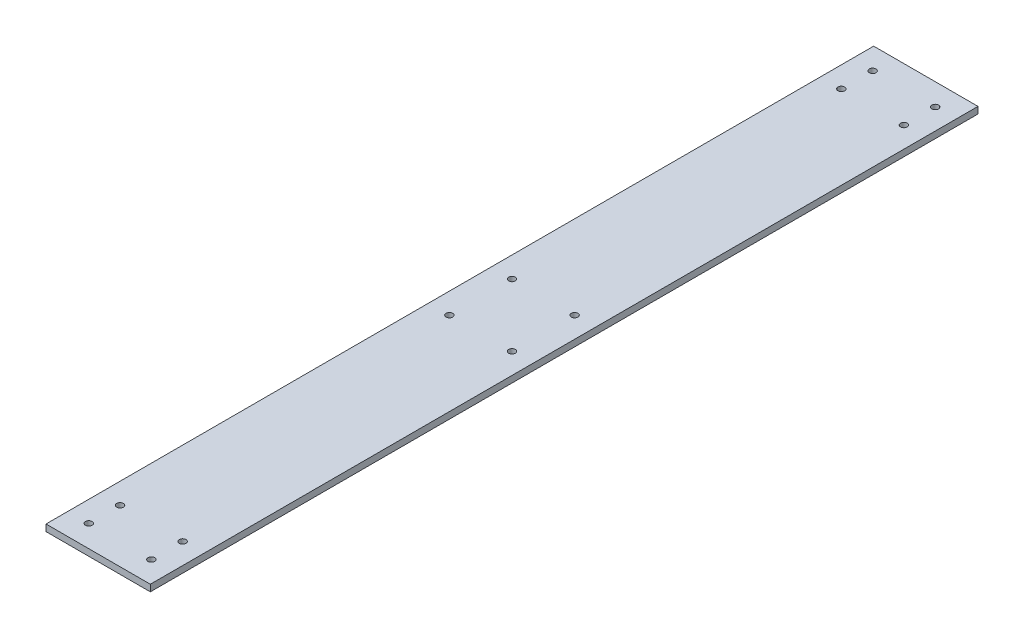
from build123d import *

# Parameters (mm, degrees)
SKETCH1_W            = 50
SKETCH1_H            = 396.65
BOSS_EXTRUDE1_DEPTH  = 3.175
M3_CLEARANCE_HOLE1_D = 3.2
M3_CLEARANCE_HOLE2_D = 3.2


with BuildPart() as part:
    # Sketch1 → Boss-Extrude1 (new body)
    with BuildSketch(Plane(origin=(0, 0, 0), x_dir=(1, 0, 0), z_dir=(0, 1, 0))):
        Rectangle(SKETCH1_W, SKETCH1_H)
    extrude(amount=BOSS_EXTRUDE1_DEPTH)

    # M3 Clearance Hole1 (through all)
    with Locations(Plane(origin=(0, 0, 0), x_dir=(-1, 0, 0), z_dir=(0, -1, 0))):
        with Locations((15, -187.825), (-15, -172.825), (-15, -187.825), (15, -172.825)):
            m3_clearance_hole1 = Hole(M3_CLEARANCE_HOLE1_D / 2)

    # Mirror1: M3 Clearance Hole1 across plane
    add(m3_clearance_hole1.mirror(Plane.XY), mode=Mode.SUBTRACT)

    # M3 Clearance Hole2 (through all)
    with Locations(Plane(origin=(0, 0, 0), x_dir=(-1, 0, 0), z_dir=(0, -1, 0))):
        with Locations((15, -15), (-15, 15), (-15, -15), (15, 15)):
            Hole(M3_CLEARANCE_HOLE2_D / 2)


solid = part.part
